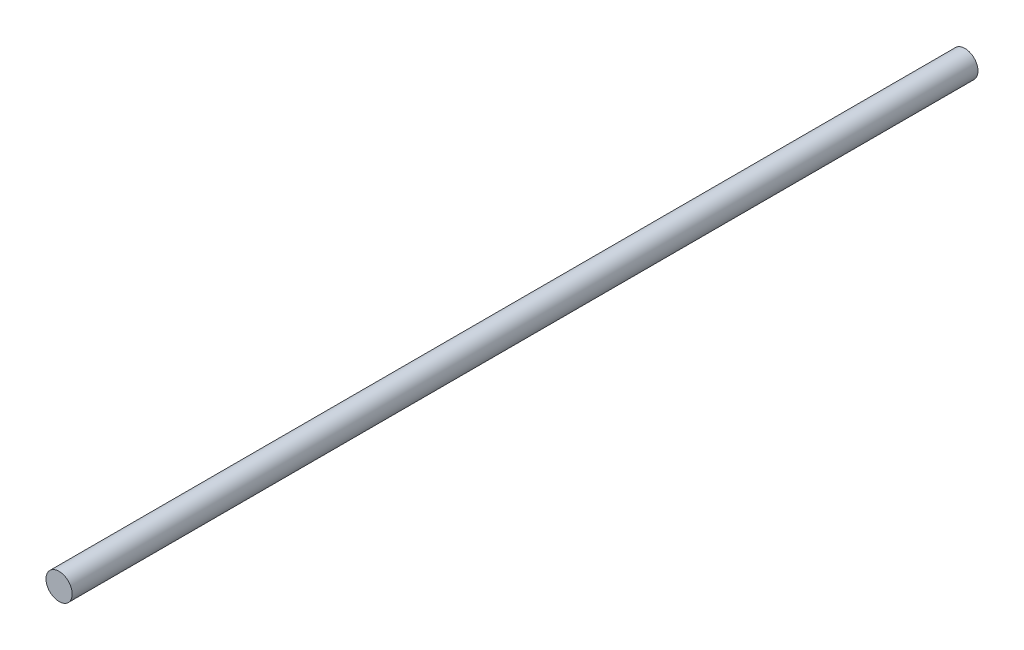
from build123d import *

# Parameters (mm, degrees)
SKETCH1_R           = 6
BOSS_EXTRUDE1_DEPTH = 414.6


with BuildPart() as part:
    # Sketch1 → Boss-Extrude1 (new body)
    with BuildSketch(Plane.XY):
        Circle(SKETCH1_R)
    extrude(amount=BOSS_EXTRUDE1_DEPTH)


solid = part.part
